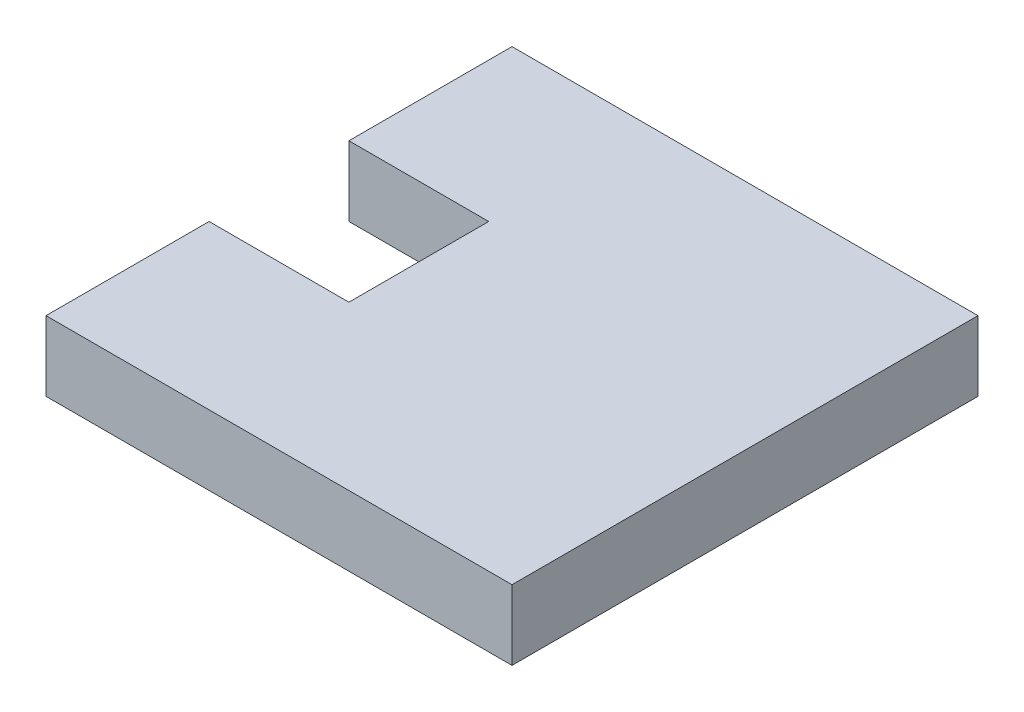
from build123d import *

# Parameters (mm, degrees)
SKIZZE1_W                            = 100
SKIZZE1_H                            = 15
AUFSATZ_LINEAR_AUSTRAGEN1_DEPTH      = 50
SCHNITT_LINEAR_AUSTRAGEN1_DEPTH      = 72.107313267
SCHNITT_LINEAR_AUSTRAGEN1_DEPTH_BACK = 72.107313267
SKIZZE2_W                            = 30
SKIZZE2_H                            = 30


with BuildPart() as part:
    # Skizze1 → Aufsatz-Linear austragen1 (new, symmetric)
    with BuildSketch(Plane.XY):
        Rectangle(SKIZZE1_W, SKIZZE1_H)
    extrude(amount=AUFSATZ_LINEAR_AUSTRAGEN1_DEPTH, both=True)

    # Skizze2 → Schnitt-Linear austragen1 (cut, two sides: drawn at the far end of the back side and taken through both)
    with BuildSketch(Plane(origin=(0, 0, 0), x_dir=(1, 0, 0), z_dir=(0, 1, 0)).offset(-SCHNITT_LINEAR_AUSTRAGEN1_DEPTH_BACK)):
        with Locations((-35, 0)):
            Rectangle(SKIZZE2_W, SKIZZE2_H)
    extrude(amount=SCHNITT_LINEAR_AUSTRAGEN1_DEPTH + SCHNITT_LINEAR_AUSTRAGEN1_DEPTH_BACK, mode=Mode.SUBTRACT)


solid = part.part
